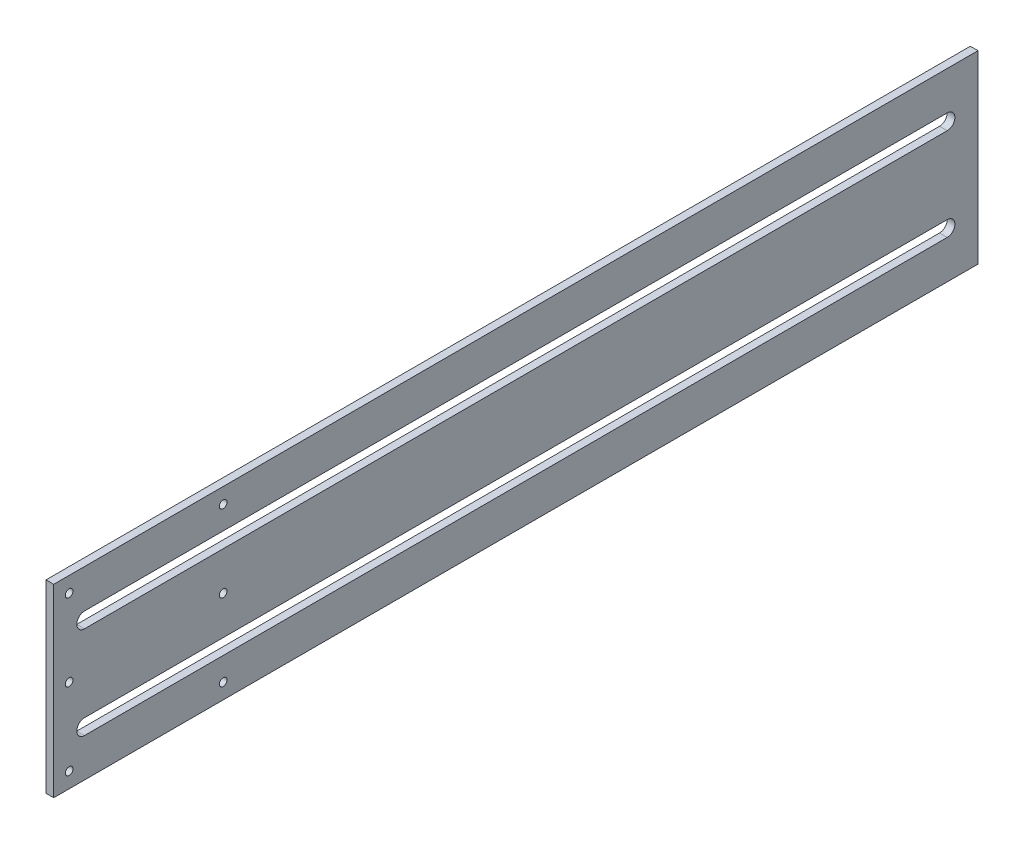
from build123d import *

# Parameters (mm, degrees)
SKETCH1_W         = 381
SKETCH1_H         = 76.2
OUTER_CUT_DEPTH   = 1.5875
SLOTS_DEPTH       = 195.298586266
SKETCH3_R         = 1.5875
MOUNT_HOLES_DEPTH = 195.298586266


with BuildPart() as part:
    # Sketch1 → Outer Cut (new, symmetric)
    with BuildSketch(Plane(origin=(0, 0, 0), x_dir=(0, 0, -1), z_dir=(1, 0, 0))):
        Rectangle(SKETCH1_W, SKETCH1_H)
    extrude(amount=OUTER_CUT_DEPTH, both=True)

    # Sketch2 → Slots (cut, through all)
    with BuildSketch(Plane(origin=(1.5875, 0, 0), x_dir=(0, 0, -1), z_dir=(1, 0, 0))):
        with BuildLine():
            Line((-177.8, 22.225), (177.8, 22.225))
            ThreePointArc((177.8, 22.225), (180.975, 19.05), (177.8, 15.875))
            Line((177.8, 15.875), (-177.8, 15.875))
            ThreePointArc((-177.8, 15.875), (-180.975, 19.05), (-177.8, 22.225))
        make_face()
        with BuildLine():
            Line((-177.8, -22.225), (177.8, -22.225))
            ThreePointArc((177.8, -22.225), (180.975, -19.05), (177.8, -15.875))
            Line((177.8, -15.875), (-177.8, -15.875))
            ThreePointArc((-177.8, -15.875), (-180.975, -19.05), (-177.8, -22.225))
        make_face()
    extrude(amount=-SLOTS_DEPTH, mode=Mode.SUBTRACT)

    # Sketch3 → Mount Holes (cut, through all)
    with BuildSketch(Plane(origin=(1.5875, 0, 0), x_dir=(0, 0, -1), z_dir=(1, 0, 0))):
        with Locations((-184.15, 31.75)):
            Circle(SKETCH3_R)
        with Locations((-120.65, 31.75)):
            Circle(SKETCH3_R)
        with Locations(Location((-120.65, -31.75, 0), (0, 0, 180))):
            Circle(SKETCH3_R)
        with Locations(Location((-184.15, -31.75, 0), (0, 0, 180))):
            Circle(SKETCH3_R)
        with Locations((-184.15, 0)):
            Circle(SKETCH3_R)
        with Locations((-120.65, 0)):
            Circle(SKETCH3_R)
    extrude(amount=-MOUNT_HOLES_DEPTH, mode=Mode.SUBTRACT)


solid = part.part
